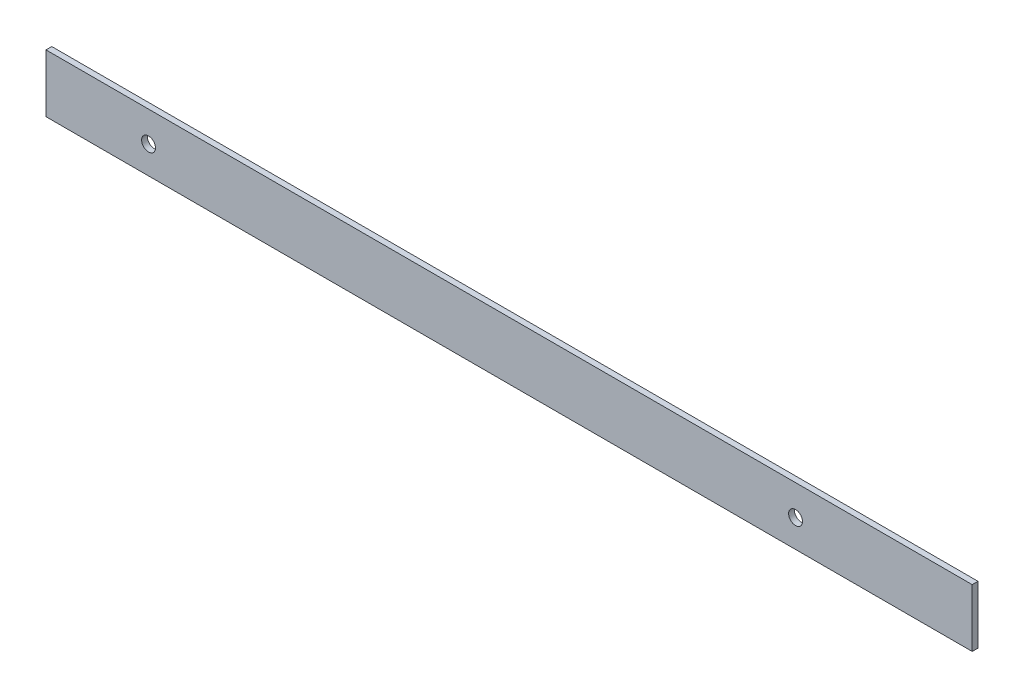
from build123d import *

# Parameters (mm, degrees)
SZKIC1_W                    = 400
SZKIC1_H                    = 50
SZKIC1_R                    = 6
DODANIE_WYCI_GNI_CIE1_DEPTH = 5


with BuildPart() as part:
    # Szkic1 → Dodanie-wyciągnięcie1 (new body)
    # profile 1 of 2: a face of its own
    with BuildSketch(Plane.XY):
        with Locations((200, 25)):
            Rectangle(SZKIC1_W, SZKIC1_H)
        with Locations((88.562871878, 23.881141178)):
            Circle(SZKIC1_R, mode=Mode.SUBTRACT)
    # profile 2 of 2: a face of its own
    with BuildSketch(Plane.XY):
        with Locations((600, 25)):
            Rectangle(SZKIC1_W, SZKIC1_H)
        with Locations((647.412196042, 23.881141178)):
            Circle(SZKIC1_R, mode=Mode.SUBTRACT)
    extrude(amount=DODANIE_WYCI_GNI_CIE1_DEPTH)


solid = part.part
